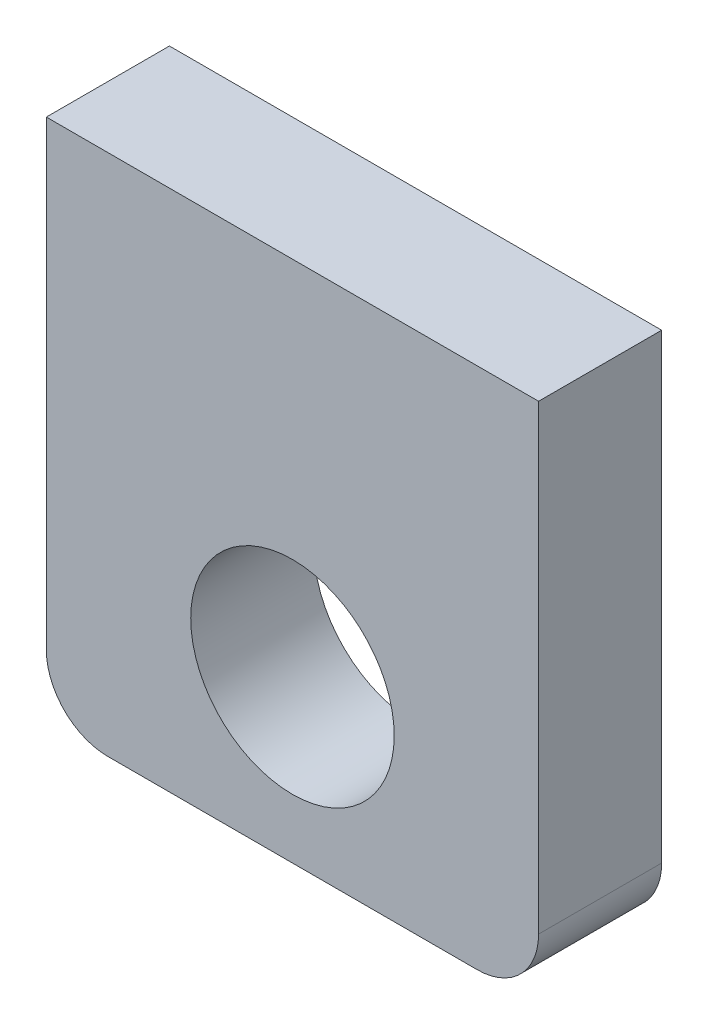
from build123d import *

# Parameters (mm, degrees)
SKETCH1_W               = 50.8
SKETCH1_H               = 53.975
BOSS_EXTRUDE1_DEPTH     = 6.35
CUT_EXTRUDE1_DEPTH      = 40.176206507
CUT_EXTRUDE1_DEPTH_BACK = 40.176206507
SKETCH2_R               = 10.499999971
FILLET1_R               = 6.35


with BuildPart() as part:
    # Sketch1 → Boss-Extrude1 (new, symmetric)
    with BuildSketch(Plane.XY):
        Rectangle(SKETCH1_W, SKETCH1_H)
    extrude(amount=BOSS_EXTRUDE1_DEPTH, both=True)

    # Sketch2 → Cut-Extrude1 (cut, two sides: drawn at the far end of the back side and taken through both)
    with BuildSketch(Plane.XY.offset(6.35).offset(-CUT_EXTRUDE1_DEPTH_BACK)):
        with Locations((0, -10.3505)):
            Circle(SKETCH2_R)
    extrude(amount=CUT_EXTRUDE1_DEPTH + CUT_EXTRUDE1_DEPTH_BACK, mode=Mode.SUBTRACT)

    # Fillet1
    fillet1_edges = [part.edges().sort_by_distance(p)[0] for p in [
        (25.4, -26.9875, 0),
        (-25.4, -26.9875, 0),
    ]]
    fillet(fillet1_edges, radius=FILLET1_R)


solid = part.part
